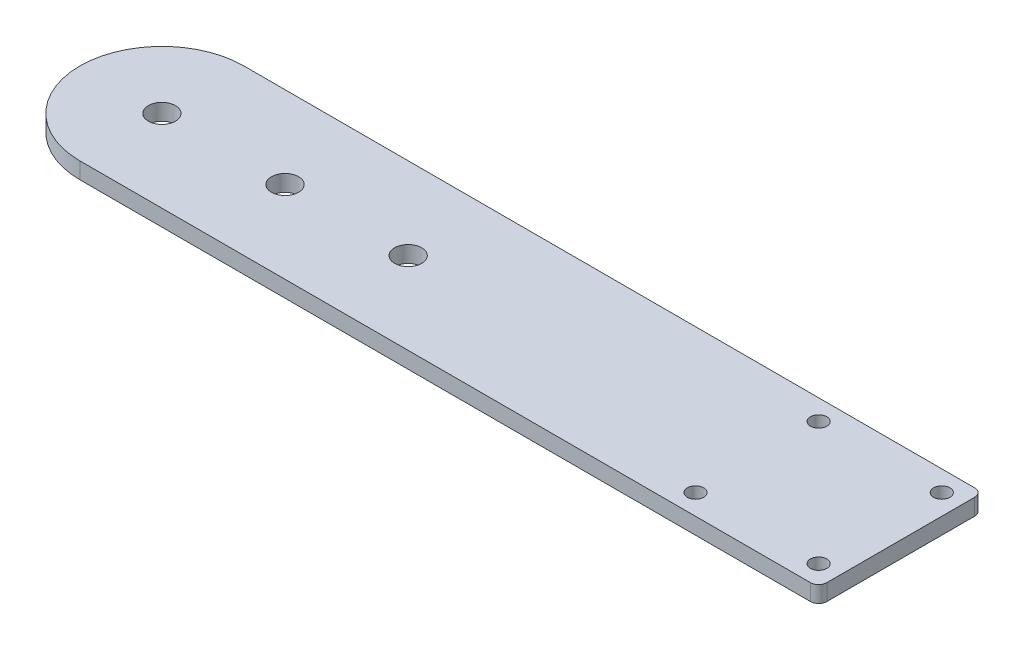
from build123d import *

# Parameters (mm, degrees)
SKETCH_1_R      = 1.65
SKETCH_1_R_2    = 1
EXTRUDE_1_DEPTH = 2
FILLET_1_R      = 1


with BuildPart() as part:
    # Эскиз1 → Бобышка-Вытянуть1 (new body)
    with BuildSketch(Plane(origin=(0, 0, 0), x_dir=(1, 0, 0), z_dir=(0, 1, 0))):
        with BuildLine():
            Line((0, 10), (90, 10))
            Line((90, 10), (90, -10))
            Line((90, -10), (0, -10))
            ThreePointArc((0, -10), (-10, 0), (0, 10))
        make_face()
        with Locations(Location((30, 0, 0), (0, 0, 270))):
            Circle(SKETCH_1_R, mode=Mode.SUBTRACT)
        with Locations(Location((0, 0, 0), (0, 0, 270))):
            Circle(SKETCH_1_R, mode=Mode.SUBTRACT)
        with Locations(Location((15, 0, 0), (0, 0, 270))):
            Circle(SKETCH_1_R, mode=Mode.SUBTRACT)
        with Locations(Location((87.5, 7.5, 0), (0, 0, 270))):
            Circle(SKETCH_1_R_2, mode=Mode.SUBTRACT)
        with Locations(Location((72.5, 7.5, 0), (0, 0, 270))):
            Circle(SKETCH_1_R_2, mode=Mode.SUBTRACT)
        with Locations(Location((87.5, -7.5, 0), (0, 0, 270))):
            Circle(SKETCH_1_R_2, mode=Mode.SUBTRACT)
        with Locations(Location((72.5, -7.5, 0), (0, 0, 270))):
            Circle(SKETCH_1_R_2, mode=Mode.SUBTRACT)
    extrude(amount=EXTRUDE_1_DEPTH)

    # Скругление1
    fillet_1_edges = [part.edges().sort_by_distance(p)[0] for p in [
        (90, 1, -10),
        (90, 1, 10),
    ]]
    fillet(fillet_1_edges, radius=FILLET_1_R)


solid = part.part
